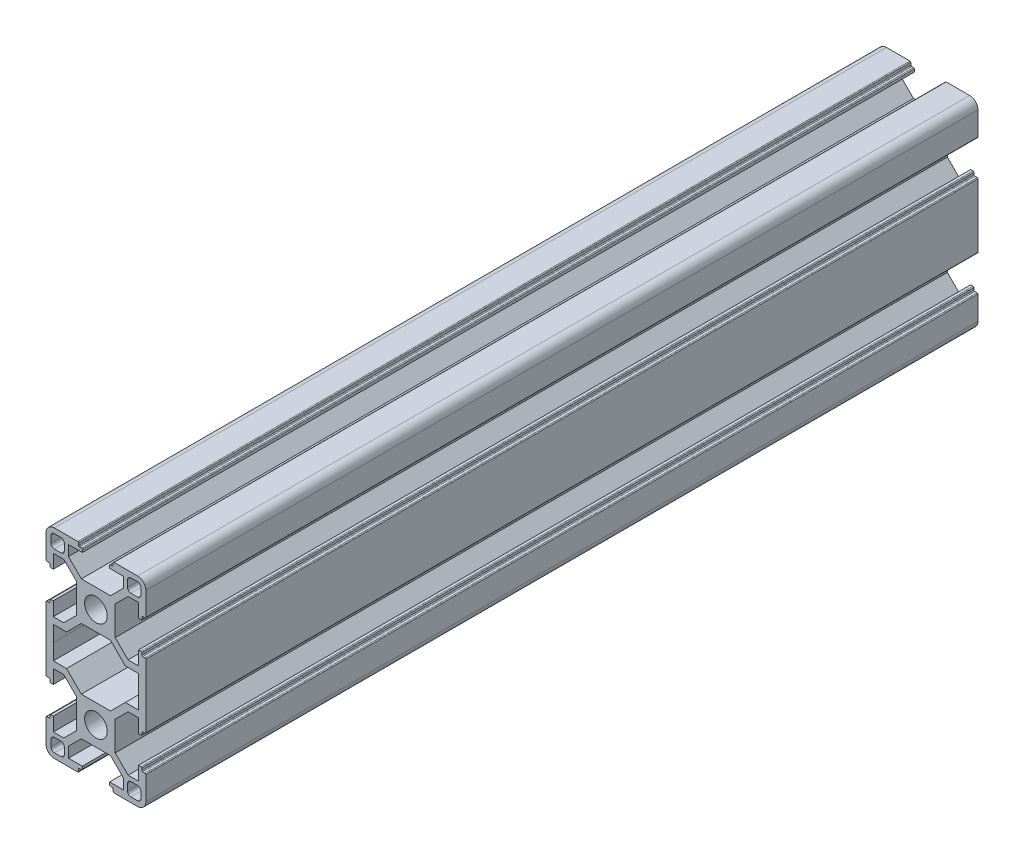
from build123d import *

# Parameters (mm, degrees)
BOSS_EXTRUDE1_DEPTH = 250
SKETCH2_R           = 3.4
CUT_EXTRUDE1_DEPTH  = 255.460213
FILLET1_R           = 2.5
FILLET2_R           = 0.25


with BuildPart() as part:
    # Sketch1 → Boss-Extrude1 (new body)
    with BuildSketch(Plane.XY):
        Polygon((-15, 15), (-5.2, 15), (-5.2, 13.808325472), (-4.1, 13.808325472), (-4.1, 12.8), (-8.25, 12.8), (-8.25, 9.664213562), (-4.385786438, 5.8), (4.385786438, 5.8), (8.25, 9.664213562), (8.25, 12.8), (4.1, 12.8), (4.1, 13.808325472), (5.2, 13.808325472), (5.2, 15), (15, 15), (15, 5.2), (13.808325472, 5.2), (13.808325472, 4.1), (12.8, 4.1), (12.8, 8.25), (9.664213562, 8.25), (5.8, 4.385786438), (5.8, -4.385786438), (9.664213562, -8.25), (12.8, -8.25), (12.8, -4.1), (13.808325472, -4.1), (13.808325472, -5.2), (15, -5.2), (15, -24.8), (13.808325472, -24.8), (13.808325472, -25.9), (12.8, -25.9), (12.8, -21.75), (9.664213562, -21.75), (5.8, -25.614213562), (5.8, -34.385786438), (9.664213562, -38.25), (12.8, -38.25), (12.8, -34.1), (13.808325472, -34.1), (13.808325472, -35.2), (15, -35.2), (15, -45), (5.2, -45), (5.2, -43.808325472), (4.1, -43.808325472), (4.1, -42.8), (8.25, -42.8), (8.25, -39.664213562), (4.385786438, -35.8), (-4.385786438, -35.8), (-8.25, -39.664213562), (-8.25, -42.8), (-4.1, -42.8), (-4.1, -43.808325472), (-5.2, -43.808325472), (-5.2, -45), (-15, -45), (-15, -35.2), (-13.808325472, -35.2), (-13.808325472, -34.1), (-12.8, -34.1), (-12.8, -38.25), (-9.664213562, -38.25), (-5.8, -34.385786438), (-5.8, -25.614213562), (-9.664213562, -21.75), (-12.8, -21.75), (-12.8, -25.9), (-13.808325472, -25.9), (-13.808325472, -24.8), (-15, -24.8), (-15, -5.2), (-13.808325472, -5.2), (-13.808325472, -4.1), (-12.8, -4.1), (-12.8, -8.25), (-9.664213562, -8.25), (-5.8, -4.385786438), (-5.8, 4.385786438), (-9.664213562, 8.25), (-12.8, 8.25), (-12.8, 4.1), (-13.808325472, 4.1), (-13.808325472, 5.2), (-15, 5.2), align=None)
        Polygon((-4.385786438, -5.8), (-8.835786438, -10.25), (-12.8, -10.25), (-12.761838387, -15), (-12.8, -19.75), (-8.835786438, -19.75), (-4.385786438, -24.2), (4.385786438, -24.2), (8.835786438, -19.75), (12.8, -19.75), (12.761838387, -15), (12.8, -10.25), (8.835786438, -10.25), (4.385786438, -5.8), align=None, mode=Mode.SUBTRACT)
    extrude(amount=BOSS_EXTRUDE1_DEPTH)

    # Sketch2 → Cut-Extrude1 (cut, through all)
    with BuildSketch(Plane.XY.offset(250)):
        with Locations(Location((0, -30, 0), (0, 0, 180))):
            Circle(SKETCH2_R)
        Circle(SKETCH2_R)
        with BuildLine():
            Line((-12.5, 13.5), (-10.5, 13.5))
            ThreePointArc((-10.5, 13.5), (-9.792893219, 13.207106781), (-9.5, 12.5))
            Line((-9.5, 12.5), (-9.5, 10.5))
            ThreePointArc((-9.5, 10.5), (-9.792893219, 9.792893219), (-10.5, 9.5))
            Line((-10.5, 9.5), (-12.5, 9.5))
            ThreePointArc((-12.5, 9.5), (-13.207106781, 9.792893219), (-13.5, 10.5))
            Line((-13.5, 10.5), (-13.5, 12.5))
            ThreePointArc((-13.5, 12.5), (-13.207106781, 13.207106781), (-12.5, 13.5))
        make_face()
        with BuildLine():
            Line((9.5, 12.5), (9.5, 10.5))
            ThreePointArc((9.5, 10.5), (9.792893219, 9.792893219), (10.5, 9.5))
            Line((10.5, 9.5), (12.5, 9.5))
            ThreePointArc((12.5, 9.5), (13.207106781, 9.792893219), (13.5, 10.5))
            Line((13.5, 10.5), (13.5, 12.5))
            ThreePointArc((13.5, 12.5), (13.207106781, 13.207106781), (12.5, 13.5))
            Line((12.5, 13.5), (10.5, 13.5))
            ThreePointArc((10.5, 13.5), (9.792893219, 13.207106781), (9.5, 12.5))
        make_face()
        with BuildLine():
            Line((12.5, -43.5), (10.5, -43.5))
            ThreePointArc((10.5, -43.5), (9.792893219, -43.207106781), (9.5, -42.5))
            Line((9.5, -42.5), (9.5, -40.5))
            ThreePointArc((9.5, -40.5), (9.792893219, -39.792893219), (10.5, -39.5))
            Line((10.5, -39.5), (12.5, -39.5))
            ThreePointArc((12.5, -39.5), (13.207106781, -39.792893219), (13.5, -40.5))
            Line((13.5, -40.5), (13.5, -42.5))
            ThreePointArc((13.5, -42.5), (13.207106781, -43.207106781), (12.5, -43.5))
        make_face()
        with BuildLine():
            Line((-9.5, -42.5), (-9.5, -40.5))
            ThreePointArc((-9.5, -40.5), (-9.792893219, -39.792893219), (-10.5, -39.5))
            Line((-10.5, -39.5), (-12.5, -39.5))
            ThreePointArc((-12.5, -39.5), (-13.207106781, -39.792893219), (-13.5, -40.5))
            Line((-13.5, -40.5), (-13.5, -42.5))
            ThreePointArc((-13.5, -42.5), (-13.207106781, -43.207106781), (-12.5, -43.5))
            Line((-12.5, -43.5), (-10.5, -43.5))
            ThreePointArc((-10.5, -43.5), (-9.792893219, -43.207106781), (-9.5, -42.5))
        make_face()
    extrude(amount=-CUT_EXTRUDE1_DEPTH, mode=Mode.SUBTRACT)

    # Fillet1
    fillet1_edges = [part.edges().sort_by_distance(p)[0] for p in [
        (-15, 15, 125),
        (15, 15, 125),
        (15, -45, 125),
        (-15, -45, 125),
    ]]
    fillet(fillet1_edges, radius=FILLET1_R)

    # Fillet2
    fillet2_edges = [part.edges().sort_by_distance(p)[0] for p in [
        (-13.808325472, 4.1, 125),
        (-13.808325472, 5.2, 125),
        (-15, 5.2, 125),
        (-5.2, 15, 125),
        (-5.2, 13.808325472, 125),
        (-4.1, 13.808325472, 125),
        (4.1, 13.808325472, 125),
        (5.2, 13.808325472, 125),
        (5.2, 15, 125),
        (15, 5.2, 125),
        (13.808325472, 5.2, 125),
        (13.808325472, 4.1, 125),
        (13.808325472, -4.1, 125),
        (13.808325472, -5.2, 125),
        (15, -5.2, 125),
        (15, -24.8, 125),
        (13.808325472, -24.8, 125),
        (13.808325472, -25.9, 125),
        (13.808325472, -34.1, 125),
        (13.808325472, -35.2, 125),
        (15, -35.2, 125),
        (5.2, -45, 125),
        (5.2, -43.808325472, 125),
        (4.1, -43.808325472, 125),
        (-4.1, -43.808325472, 125),
        (-5.2, -43.808325472, 125),
        (-5.2, -45, 125),
        (-15, -35.2, 125),
        (-13.808325472, -35.2, 125),
        (-13.808325472, -34.1, 125),
        (-13.808325472, -25.9, 125),
        (-13.808325472, -24.8, 125),
        (-15, -24.8, 125),
        (-15, -5.2, 125),
        (-13.808325472, -5.2, 125),
        (-13.808325472, -4.1, 125),
    ]]
    fillet(fillet2_edges, radius=FILLET2_R)


solid = part.part
